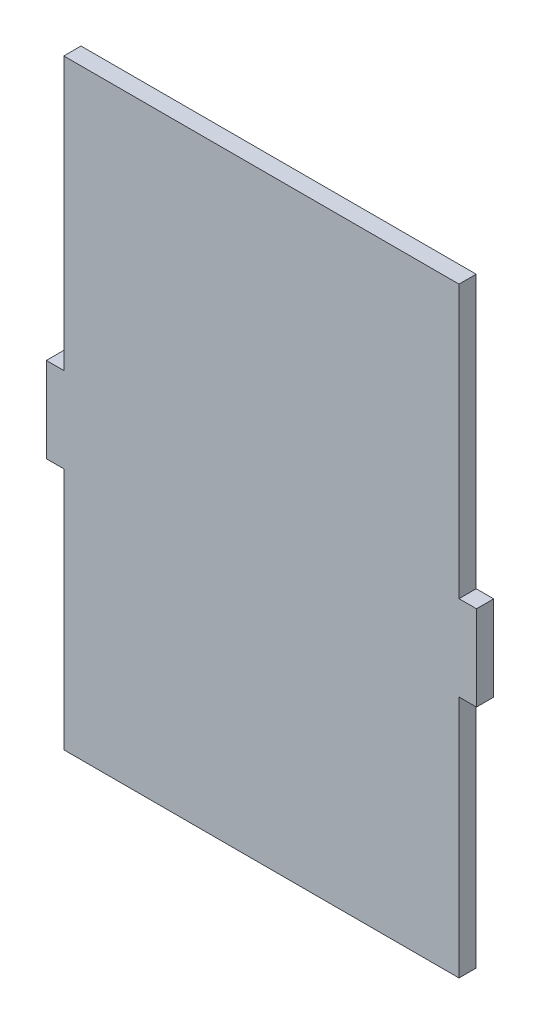
from build123d import *

# Parameters (mm, degrees)
EXTRUDE_1_DEPTH     = 2
SKETCH_2_W          = 45.974
SKETCH_2_H          = 20
SKETCH_2_H_2        = 15
CUT_EXTRUDE_1_DEPTH = 10


with BuildPart() as part:
    # Эскиз1 → Бобышка-Вытянуть1 (new body)
    with BuildSketch(Plane.XY):
        Polygon((0, -61.595), (0, -104.902), (-45.974, -104.902), (-45.974, -61.595), (-48.006, -61.595), (-48.006, -51.689), (-45.974, -51.689), (-45.974, 0), (0, 0), (0, -51.689), (2.032, -51.689), (2.032, -61.595), align=None)
    extrude(amount=EXTRUDE_1_DEPTH)

    # Эскиз2 → Вырез-Вытянуть1 (cut)
    with BuildSketch(Plane(origin=(0, 0, 0), x_dir=(-1, 0, 0), z_dir=(0, 0, -1))):
        with Locations((22.987, -10)):
            Rectangle(SKETCH_2_W, SKETCH_2_H)
        with Locations((22.987, -97.402)):
            Rectangle(SKETCH_2_W, SKETCH_2_H_2)
    extrude(amount=-CUT_EXTRUDE_1_DEPTH, mode=Mode.SUBTRACT)


solid = part.part
